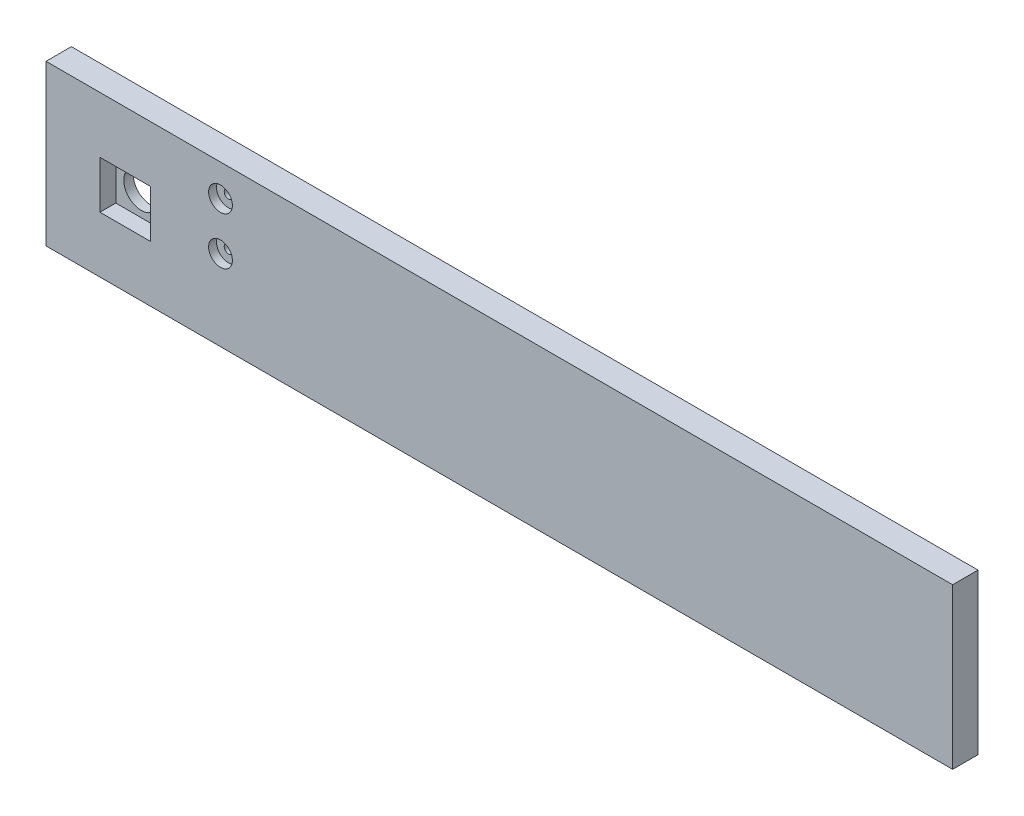
from build123d import *

# Parameters (mm, degrees)
SKETCH1_W               = 571.5
SKETCH1_H               = 100.8
BOSS_EXTRUDE1_DEPTH     = 8
CUT_EXTRUDE1_DEPTH      = 581.541893406
CUT_EXTRUDE1_DEPTH_BACK = 581.541893406
SKETCH9_R               = 11
SKETCH9_R_2             = 2.65
SKETCH10_W              = 32
SKETCH10_H              = 30
CUT_EXTRUDE2_DEPTH      = 10
SKETCH11_R              = 7.5
CUT_EXTRUDE3_DEPTH      = 5
CUT_EXTRUDE4_START      = -11
SKETCH11_2_R            = 7.5
CUT_EXTRUDE4_DEPTH      = 5


with BuildPart() as part:
    # Sketch1 → Boss-Extrude1 (new, symmetric)
    with BuildSketch(Plane.XY):
        with Locations((285.75, 50.4)):
            Rectangle(SKETCH1_W, SKETCH1_H)
    extrude(amount=BOSS_EXTRUDE1_DEPTH, both=True)

    # Sketch9 → Cut-Extrude1 (cut, two sides: drawn at the far end of the back side and taken through both)
    with BuildSketch(Plane.XY.offset(8).offset(-CUT_EXTRUDE1_DEPTH_BACK)):
        with Locations((50, 50.4)):
            Circle(SKETCH9_R)
        with Locations((110, 80.8)):
            Circle(SKETCH9_R_2)
        with Locations((110, 50.8)):
            Circle(SKETCH9_R_2)
    extrude(amount=CUT_EXTRUDE1_DEPTH + CUT_EXTRUDE1_DEPTH_BACK, mode=Mode.SUBTRACT)

    # Sketch10 → Cut-Extrude2 (cut)
    with BuildSketch(Plane.XY.offset(8)):
        with Locations((50, 50.4)):
            Rectangle(SKETCH10_W, SKETCH10_H)
    extrude(amount=-CUT_EXTRUDE2_DEPTH, mode=Mode.SUBTRACT)

    # Sketch11 → Cut-Extrude3 (cut)
    with BuildSketch(Plane.XY.offset(8)):
        with Locations((110, 80.8)):
            Circle(SKETCH11_R)
        with Locations((110, 50.8)):
            Circle(SKETCH11_R)
    extrude(amount=-CUT_EXTRUDE3_DEPTH, mode=Mode.SUBTRACT)

    # Sketch11<2> → Cut-Extrude4 (cut)
    with BuildSketch(Plane.XY.offset(8).offset(CUT_EXTRUDE4_START)):
        with Locations((110, 80.8)):
            Circle(SKETCH11_2_R)
        with Locations((110, 50.8)):
            Circle(SKETCH11_2_R)
    extrude(amount=-CUT_EXTRUDE4_DEPTH, mode=Mode.SUBTRACT)


solid = part.part
